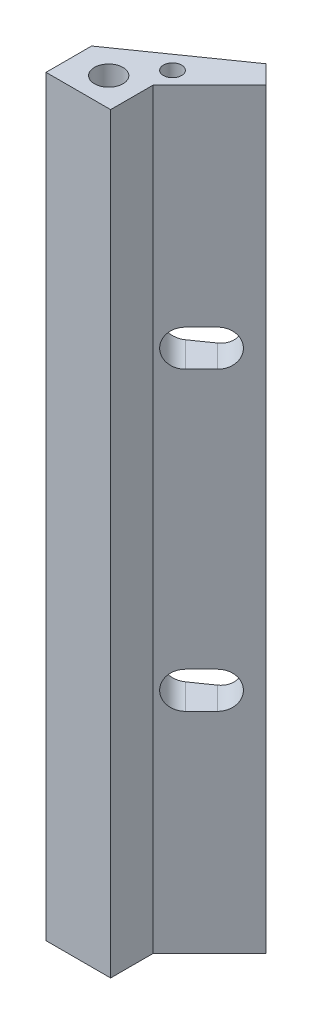
from build123d import *

# Parameters (mm, degrees)
BOSS_EXTRUDE1_DEPTH             = 66
CUT_EXTRUDE1_DEPTH              = 67.929463958
CUT_EXTRUDE2_REACH              = 68.929
F_2_5_2_5_DIAMETER_HOLE1_D      = 2.5
F_2_5_2_5_DIAMETER_HOLE1_DEPTH  = 8
F_2_5_2_5_DIAMETER_HOLE1_TIP    = 0.751075774
TAP_DRILL_FOR_M2X0_4_TAP1_D     = 1.6
TAP_DRILL_FOR_M2X0_4_TAP1_DEPTH = 8
TAP_DRILL_FOR_M2X0_4_TAP1_TIP   = 0.480688495
F_2_5_2_5_DIAMETER_HOLE2_D      = 2.5
F_2_5_2_5_DIAMETER_HOLE2_DEPTH  = 8
F_2_5_2_5_DIAMETER_HOLE2_TIP    = 0.751075774
TAP_DRILL_FOR_M2X0_4_TAP2_D     = 1.6
TAP_DRILL_FOR_M2X0_4_TAP2_DEPTH = 8
TAP_DRILL_FOR_M2X0_4_TAP2_TIP   = 0.480688495


with BuildPart() as part:
    # Sketch1 → Boss-Extrude1 (new body)
    with BuildSketch(Plane(origin=(0, 66, 0), x_dir=(1, 0, 0), z_dir=(0, 1, 0))):
        Polygon((2.999999997, 0.701867841), (-6, -5.599999997), (-6, -9.6), (-0.331046591, -9.6), (-0.331046591, -5.866580498), (4.618700872, -0.916833034), align=None)
    extrude(amount=-BOSS_EXTRUDE1_DEPTH)

    # Sketch2 → Cut-Extrude1 (cut, through all)
    with BuildSketch(Plane(origin=(2.767766953, 0, 2.767766953), x_dir=(0.7071067811865476, 0, -0.7071067811865476), z_dir=(0.7071067811865476, 0, 0.7071067811865476))):
        with BuildLine():
            Line((-0.382384145, 47.599999993), (-2.382384145, 47.599999993))
            ThreePointArc((-2.382384145, 47.599999993), (-3.982384137, 46.000000001), (-2.382384145, 44.400000009))
            Line((-2.382384145, 44.400000009), (-0.382384145, 44.400000009))
            ThreePointArc((-0.382384145, 44.400000009), (1.217615847, 46.000000001), (-0.382384145, 47.599999993))
        make_face()
    extrude(amount=-CUT_EXTRUDE1_DEPTH, mode=Mode.SUBTRACT)

    # Cut-Extrude2: up to this plane
    cut_extrude2_end = Plane(origin=(2.999999997, 0, -0.701867841), z_dir=(-0.5735764361404622, 0, -0.8191520444364443))
    # Sketch3 → Cut-Extrude2 (cut, up to the surface)
    with BuildSketch(Plane(origin=(2.767766953, 0, 2.767766953), x_dir=(0.7071067811865476, 0, -0.7071067811865476), z_dir=(0.7071067811865476, 0, 0.7071067811865476)), mode=Mode.PRIVATE) as cut_extrude2_sk1:
        with BuildLine():
            Line((-0.382384145, 21.599999991), (-2.382384145, 21.599999991))
            ThreePointArc((-2.382384145, 21.599999991), (-3.982384137, 19.999999999), (-2.382384145, 18.400000007))
            Line((-2.382384145, 18.400000007), (-0.382384145, 18.400000007))
            ThreePointArc((-0.382384145, 18.400000007), (1.217615847, 19.999999999), (-0.382384145, 21.599999991))
        make_face()
    cut_extrude2_tool1 = split(extrude(cut_extrude2_sk1.sketch, amount=-CUT_EXTRUDE2_REACH, mode=Mode.PRIVATE), bisect_by=cut_extrude2_end, keep=Keep.BOTH, mode=Mode.PRIVATE)
    add(cut_extrude2_tool1.solids().sort_by_distance((1.790274, 20, 3.74526))[0], mode=Mode.SUBTRACT)

    # Ø2.5 (2.5) Diameter Hole1
    with Locations(Plane(origin=(0, 0, 0), x_dir=(-1, 0, 0), z_dir=(0, -1, 0))):
        with Locations((3, -7.1)):
            Hole(F_2_5_2_5_DIAMETER_HOLE1_D / 2, depth=F_2_5_2_5_DIAMETER_HOLE1_DEPTH)
            with Locations((0, 0, -(F_2_5_2_5_DIAMETER_HOLE1_DEPTH + F_2_5_2_5_DIAMETER_HOLE1_TIP / 2))):  # 118° drill point
                Cone(0, F_2_5_2_5_DIAMETER_HOLE1_D / 2, F_2_5_2_5_DIAMETER_HOLE1_TIP, mode=Mode.SUBTRACT)

    # Tap Drill for M2x0.4 Tap1
    with Locations(Plane(origin=(0, 0, 0), x_dir=(-1, 0, 0), z_dir=(0, -1, 0))):
        with Locations((0.604004818, -3.897000298)):
            Hole(TAP_DRILL_FOR_M2X0_4_TAP1_D / 2, depth=TAP_DRILL_FOR_M2X0_4_TAP1_DEPTH)
            with Locations((0, 0, -(TAP_DRILL_FOR_M2X0_4_TAP1_DEPTH + TAP_DRILL_FOR_M2X0_4_TAP1_TIP / 2))):  # 118° drill point
                Cone(0, TAP_DRILL_FOR_M2X0_4_TAP1_D / 2, TAP_DRILL_FOR_M2X0_4_TAP1_TIP, mode=Mode.SUBTRACT)

    # Ø2.5 (2.5) Diameter Hole2
    with Locations(Plane(origin=(0, 66, 0), x_dir=(1, 0, 0), z_dir=(0, 1, 0))):
        with Locations((-3, -7.1)):
            Hole(F_2_5_2_5_DIAMETER_HOLE2_D / 2, depth=F_2_5_2_5_DIAMETER_HOLE2_DEPTH)
            with Locations((0, 0, -(F_2_5_2_5_DIAMETER_HOLE2_DEPTH + F_2_5_2_5_DIAMETER_HOLE2_TIP / 2))):  # 118° drill point
                Cone(0, F_2_5_2_5_DIAMETER_HOLE2_D / 2, F_2_5_2_5_DIAMETER_HOLE2_TIP, mode=Mode.SUBTRACT)

    # Tap Drill for M2x0.4 Tap2
    with Locations(Plane(origin=(0, 66, 0), x_dir=(1, 0, 0), z_dir=(0, 1, 0))):
        with Locations((-0.604004818, -3.897000298)):
            Hole(TAP_DRILL_FOR_M2X0_4_TAP2_D / 2, depth=TAP_DRILL_FOR_M2X0_4_TAP2_DEPTH)
            with Locations((0, 0, -(TAP_DRILL_FOR_M2X0_4_TAP2_DEPTH + TAP_DRILL_FOR_M2X0_4_TAP2_TIP / 2))):  # 118° drill point
                Cone(0, TAP_DRILL_FOR_M2X0_4_TAP2_D / 2, TAP_DRILL_FOR_M2X0_4_TAP2_TIP, mode=Mode.SUBTRACT)


solid = part.part
